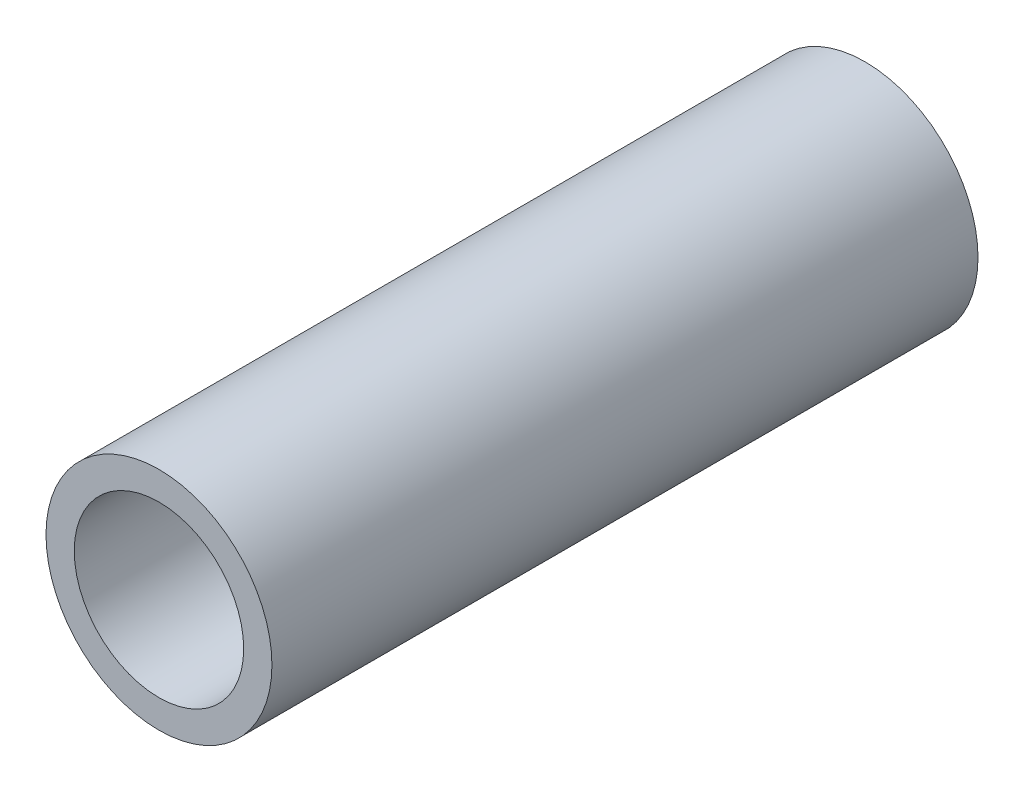
from build123d import *

# Parameters (mm, degrees)
SKETCH1_R           = 4
SKETCH1_R_2         = 3
BOSS_EXTRUDE1_DEPTH = 25


with BuildPart() as part:
    # Sketch1 → Boss-Extrude1 (new body)
    with BuildSketch(Plane.XY):
        Circle(SKETCH1_R)
        Circle(SKETCH1_R_2, mode=Mode.SUBTRACT)
    extrude(amount=BOSS_EXTRUDE1_DEPTH)


solid = part.part
